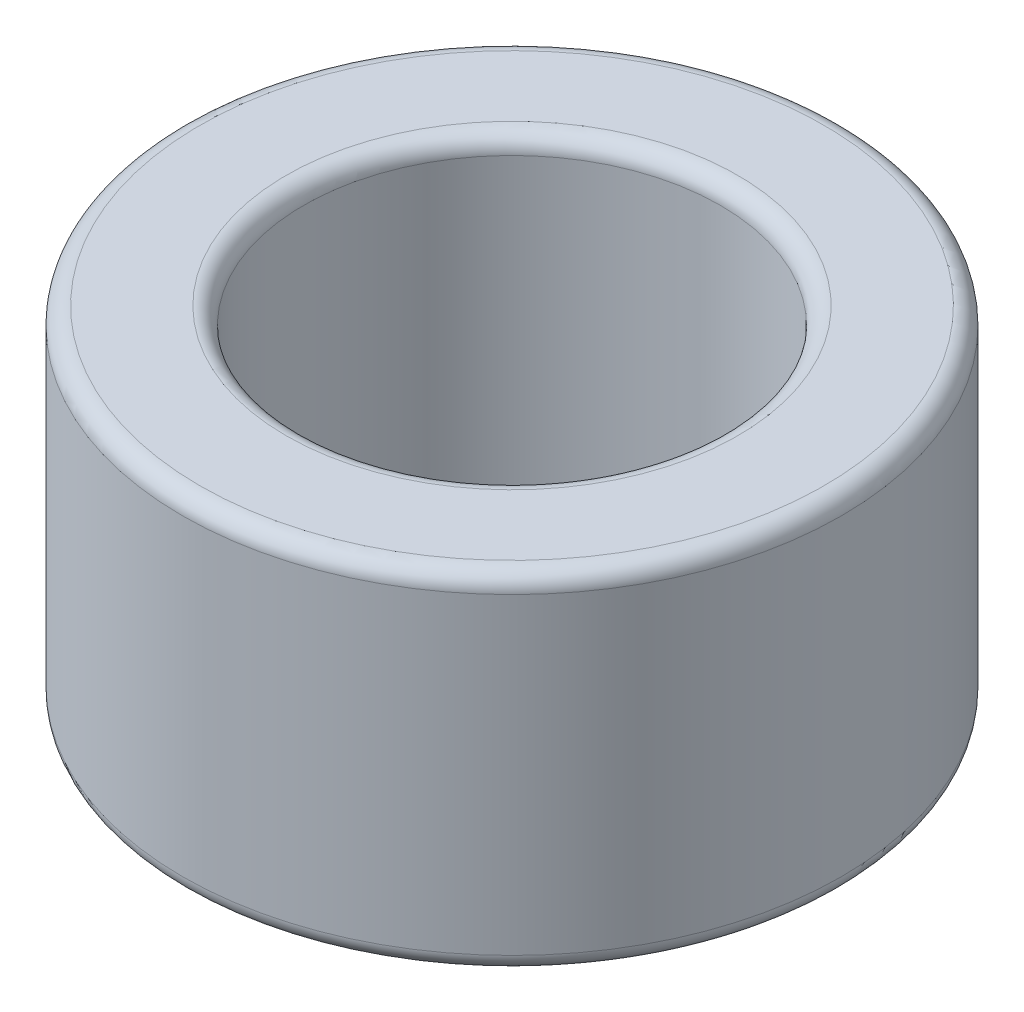
from build123d import *

# Parameters (mm, degrees)
SKETCH1_R           = 4.745
SKETCH1_R_2         = 3
BOSS_EXTRUDE1_DEPTH = 5
FILLET1_R           = 0.25


with BuildPart() as part:
    # Sketch1 → Boss-Extrude1 (new body)
    with BuildSketch(Plane(origin=(0, 0, 0), x_dir=(1, 0, 0), z_dir=(0, 1, 0))):
        with Locations(Location((0, 0, 0), (0, 0, 270))):
            Circle(SKETCH1_R)
        with Locations(Location((0, 0, 0), (0, 0, 270))):
            Circle(SKETCH1_R_2, mode=Mode.SUBTRACT)
    extrude(amount=BOSS_EXTRUDE1_DEPTH)

    # Fillet1
    fillet1_edges = [part.edges().sort_by_distance(p)[0] for p in [
        (0, 0, -4.745),
        (0, 5, -4.745),
        (0, 0, -3),
        (0, 5, -3),
    ]]
    fillet(fillet1_edges, radius=FILLET1_R)


solid = part.part
